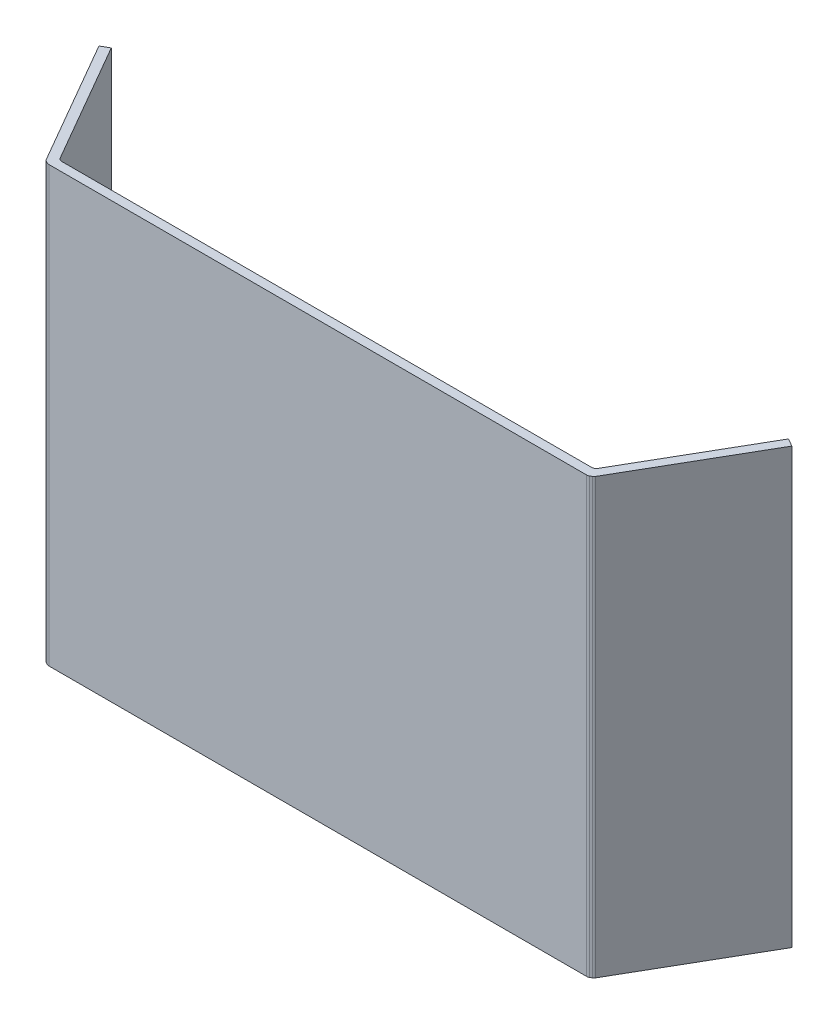
from build123d import *

# Parameters (mm, degrees)
BOSS_EXTRUDE1_DEPTH = 152.4
FILLET1_R           = 1.5875


with BuildPart() as part:
    # Sketch1 → Boss-Extrude1 (new body)
    with BuildSketch(Plane(origin=(0, 0, 0), x_dir=(1, 0, 0), z_dir=(0, 1, 0))):
        Polygon((94.7975625, -1.5875), (-94.7975625, -1.5875), (-96.172377829, -0.79375), (-121.572377829, 43.200340512), (-118.822747171, 44.787840512), (-93.881018948, 1.5875), (93.881018948, 1.5875), (118.822747171, 44.787840512), (121.572377829, 43.200340512), (96.172377829, -0.79375), align=None)
    extrude(amount=BOSS_EXTRUDE1_DEPTH)

    # Fillet1
    fillet1_edges = [part.edges().sort_by_distance(p)[0] for p in [
        (94.7975625, 76.2, 1.5875),
        (-94.7975625, 76.2, 1.5875),
        (-96.172377829, 76.2, 0.79375),
        (-93.881018948, 76.2, -1.5875),
        (93.881018948, 76.2, -1.5875),
        (96.172377829, 76.2, 0.79375),
    ]]
    fillet(fillet1_edges, radius=FILLET1_R)


solid = part.part
